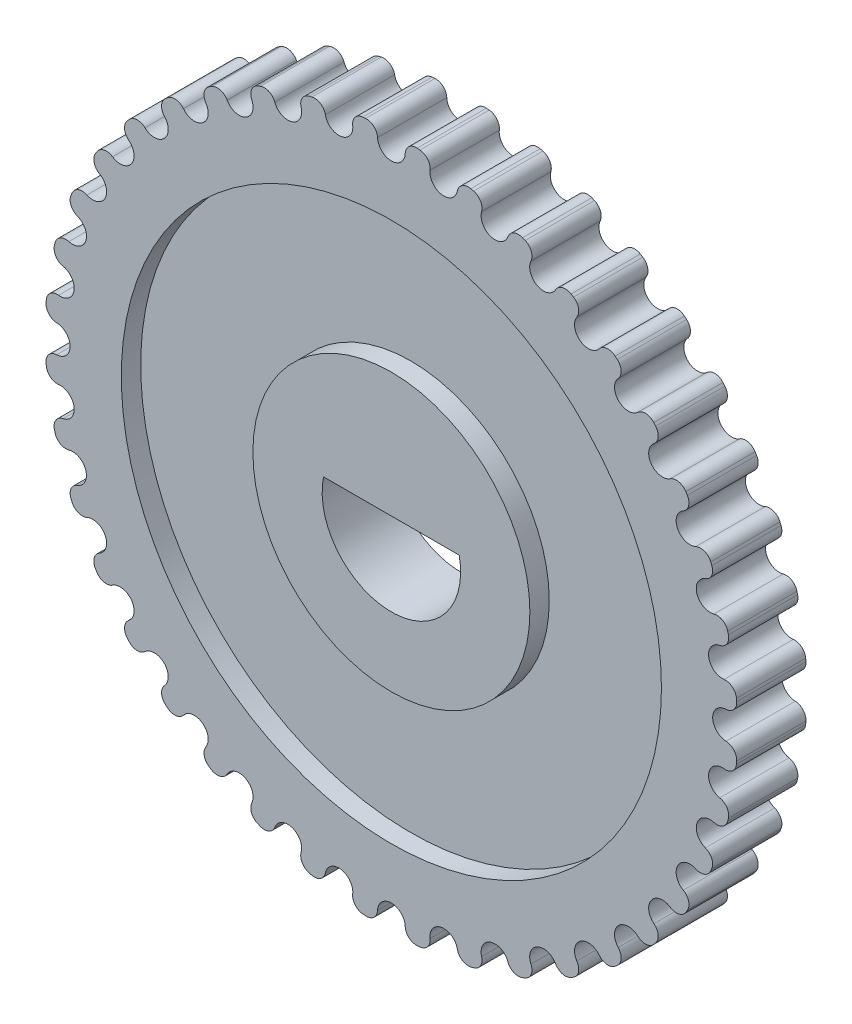
from build123d import *

# Parameters (mm, degrees)
SKETCH1_R                = 25
BOSS_EXTRUDE1_DEPTH      = 2.5
SKETCH2_R                = 19.5
SKETCH2_R_2              = 10
CUT_EXTRUDE1_DEPTH       = 1.4
CUT_EXTRUDE2_DEPTH       = 36.707142143
FILLET1_R                = 0.8
CIRPATTERN1_COUNT        = 40
FILLET1_OF_CIRPATTERN1_R = 0.8
CUT_EXTRUDE3_DEPTH       = 36.613407006


with BuildPart() as part:
    # Sketch1 → Boss-Extrude1 (new, symmetric)
    with BuildSketch(Plane.XY):
        Circle(SKETCH1_R)
    extrude(amount=BOSS_EXTRUDE1_DEPTH, both=True)

    # Sketch2 → Cut-Extrude1 (cut)
    with BuildSketch(Plane.XY.offset(2.5)):
        Circle(SKETCH2_R)
        Circle(SKETCH2_R_2, mode=Mode.SUBTRACT)
    cut_extrude1 = extrude(amount=-CUT_EXTRUDE1_DEPTH, mode=Mode.SUBTRACT)

    # Mirror1: Cut-Extrude1 across plane
    add(cut_extrude1.mirror(Plane.XY), mode=Mode.SUBTRACT)

    # Sketch3 → Cut-Extrude2 (cut, through all)
    with BuildSketch(Plane.XY.offset(2.5)):
        with BuildLine():
            Line((-1, 24.2), (-1, 25.2))
            Line((-1, 25.2), (1, 25.2))
            Line((1, 25.2), (1, 24.2))
            ThreePointArc((1, 24.2), (0, 23.2), (-1, 24.2))
        make_face()
    cut_extrude2 = extrude(amount=-CUT_EXTRUDE2_DEPTH, mode=Mode.SUBTRACT)

    # Fillet1
    fillet1_edges = [part.edges().sort_by_distance(p)[0] for p in [
        (1, 24.979991994, 0),
        (-1, 24.979991994, 0),
    ]]
    fillet(fillet1_edges, radius=FILLET1_R)

    # CirPattern1: Cut-Extrude2 ×40 about axis
    cirpattern1_axis = Axis((0, 0, 0), (0, 0, 1))
    for i in range(1, CIRPATTERN1_COUNT):
        add(cut_extrude2.rotate(cirpattern1_axis, i * 360 / CIRPATTERN1_COUNT), mode=Mode.SUBTRACT)

    # Fillet1 of CirPattern1
    fillet1_of_cirpattern1_edges = [part.edges().sort_by_distance(p)[0] for p in [
        (-2.920043344, 24.828881305, 0),
        (-4.895420025, 24.516012375, 0),
        (-6.768185529, 24.066401157, 0),
        (-8.670298562, 23.448367168, 0),
        (-10.449672524, 22.71132634, 0),
        (-12.231685573, 21.803345341, 0),
        (-13.873853902, 20.797023294, 0),
        (-15.491887891, 19.62145279, 0),
        (-16.956414951, 18.370628514, 0),
        (-18.370628514, 16.956414951, 0),
        (-19.62145279, 15.491887891, 0),
        (-20.797023294, 13.873853902, 0),
        (-21.803345341, 12.231685573, 0),
        (-22.71132634, 10.449672524, 0),
        (-23.448367168, 8.670298562, 0),
        (-24.066401157, 6.768185529, 0),
        (-24.516012375, 4.895420025, 0),
        (-24.828881305, 2.920043344, 0),
        (-24.979991994, 1, 0),
        (-24.979991994, -1, 0),
        (-24.828881305, -2.920043344, 0),
        (-24.516012375, -4.895420025, 0),
        (-24.066401157, -6.768185529, 0),
        (-23.448367168, -8.670298562, 0),
        (-22.71132634, -10.449672524, 0),
        (-21.803345341, -12.231685573, 0),
        (-20.797023294, -13.873853902, 0),
        (-19.62145279, -15.491887891, 0),
        (-18.370628514, -16.956414951, 0),
        (-16.956414951, -18.370628514, 0),
        (-15.491887891, -19.62145279, 0),
        (-13.873853902, -20.797023294, 0),
        (-12.231685573, -21.803345341, 0),
        (-10.449672524, -22.71132634, 0),
        (-8.670298562, -23.448367168, 0),
        (-6.768185529, -24.066401157, 0),
        (-4.895420025, -24.516012375, 0),
        (-2.920043344, -24.828881305, 0),
        (-1, -24.979991994, 0),
        (1, -24.979991994, 0),
        (2.920043344, -24.828881305, 0),
        (4.895420025, -24.516012375, 0),
        (6.768185529, -24.066401157, 0),
        (8.670298562, -23.448367168, 0),
        (10.449672524, -22.71132634, 0),
        (12.231685573, -21.803345341, 0),
        (13.873853902, -20.797023294, 0),
        (15.491887891, -19.62145279, 0),
        (16.956414951, -18.370628514, 0),
        (18.370628514, -16.956414951, 0),
        (19.62145279, -15.491887891, 0),
        (20.797023294, -13.873853902, 0),
        (21.803345341, -12.231685573, 0),
        (22.71132634, -10.449672524, 0),
        (23.448367168, -8.670298562, 0),
        (24.066401157, -6.768185529, 0),
        (24.516012375, -4.895420025, 0),
        (24.828881305, -2.920043344, 0),
        (24.979991994, -1, 0),
        (24.979991994, 1, 0),
        (24.828881305, 2.920043344, 0),
        (24.516012375, 4.895420025, 0),
        (24.066401157, 6.768185529, 0),
        (23.448367168, 8.670298562, 0),
        (22.71132634, 10.449672524, 0),
        (21.803345341, 12.231685573, 0),
        (20.797023294, 13.873853902, 0),
        (19.62145279, 15.491887891, 0),
        (18.370628514, 16.956414951, 0),
        (16.956414951, 18.370628514, 0),
        (15.491887891, 19.62145279, 0),
        (13.873853902, 20.797023294, 0),
        (12.231685573, 21.803345341, 0),
        (10.449672524, 22.71132634, 0),
        (8.670298562, 23.448367168, 0),
        (6.768185529, 24.066401157, 0),
        (4.895420025, 24.516012375, 0),
        (2.920043344, 24.828881305, 0),
    ]]
    fillet(fillet1_of_cirpattern1_edges, radius=FILLET1_OF_CIRPATTERN1_R)

    # Sketch4 → Cut-Extrude3 (cut, through all)
    with BuildSketch(Plane.XY.offset(2.5)):
        with BuildLine():
            Line((-4.898979486, 1), (4.898979486, 1))
            ThreePointArc((4.898979486, 1), (0, -5), (-4.898979486, 1))
        make_face()
    extrude(amount=-CUT_EXTRUDE3_DEPTH, mode=Mode.SUBTRACT)


solid = part.part
